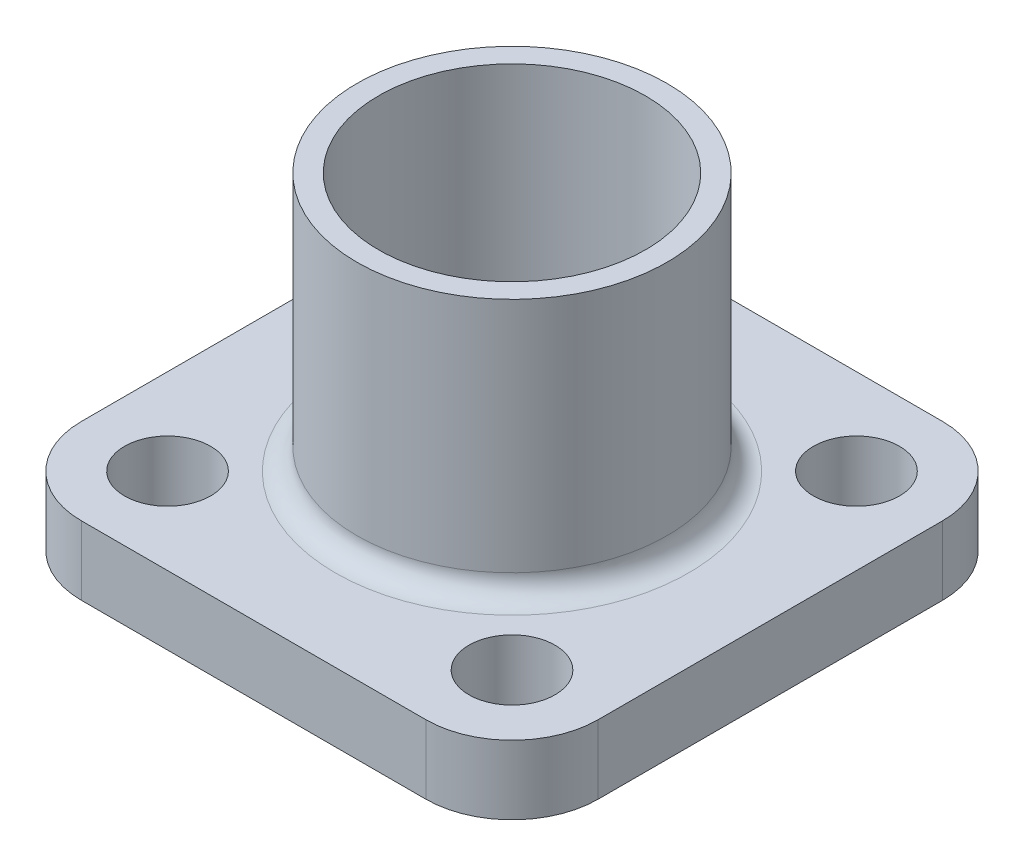
from build123d import *

# Parameters (mm, degrees)
SKETCH1_W           = 19.05
SKETCH1_H           = 19.05
SKETCH1_R           = 1.5875
SKETCH1_R_2         = 3.96875
BOSS_EXTRUDE1_DEPTH = 2.54
SKETCH2_R           = 5.715
SKETCH2_R_2         = 4.92125
BOSS_EXTRUDE2_DEPTH = 9.525
FILLET1_R           = 0.79375
FILLET2_R           = 3.175


with BuildPart() as part:
    # Sketch1 → Boss-Extrude1 (new body)
    with BuildSketch(Plane(origin=(0, 0, 0), x_dir=(1, 0, 0), z_dir=(0, 1, 0))):
        Rectangle(SKETCH1_W, SKETCH1_H)
        with Locations(Location((-6.35, 6.35, 0), (0, 0, 270))):
            Circle(SKETCH1_R, mode=Mode.SUBTRACT)
        with Locations(Location((6.35, 6.35, 0), (0, 0, 270))):
            Circle(SKETCH1_R, mode=Mode.SUBTRACT)
        with Locations(Location((6.35, -6.35, 0), (0, 0, 270))):
            Circle(SKETCH1_R, mode=Mode.SUBTRACT)
        with Locations(Location((-6.35, -6.35, 0), (0, 0, 270))):
            Circle(SKETCH1_R, mode=Mode.SUBTRACT)
        with Locations(Location((0, 0, 0), (0, 0, 270))):
            Circle(SKETCH1_R_2, mode=Mode.SUBTRACT)
    extrude(amount=BOSS_EXTRUDE1_DEPTH)

    # Sketch2 → Boss-Extrude2 (add)
    with BuildSketch(Plane(origin=(0, 2.54, 0), x_dir=(1, 0, 0), z_dir=(0, 1, 0))):
        with Locations(Location((0, 0, 0), (0, 0, 90))):
            Circle(SKETCH2_R)
        with Locations(Location((0, 0, 0), (0, 0, 90))):
            Circle(SKETCH2_R_2, mode=Mode.SUBTRACT)
    extrude(amount=BOSS_EXTRUDE2_DEPTH)

    # Fillet1
    fillet1_edges = [part.edges().sort_by_distance(p)[0] for p in [
        (0, 2.54, 5.715),
        (0, 2.54, 4.92125),
    ]]
    fillet(fillet1_edges, radius=FILLET1_R)

    # Fillet2
    fillet2_edges = [part.edges().sort_by_distance(p)[0] for p in [
        (9.525, 1.27, 9.525),
        (-9.525, 1.27, 9.525),
        (-9.525, 1.27, -9.525),
        (9.525, 1.27, -9.525),
    ]]
    fillet(fillet2_edges, radius=FILLET2_R)


solid = part.part
